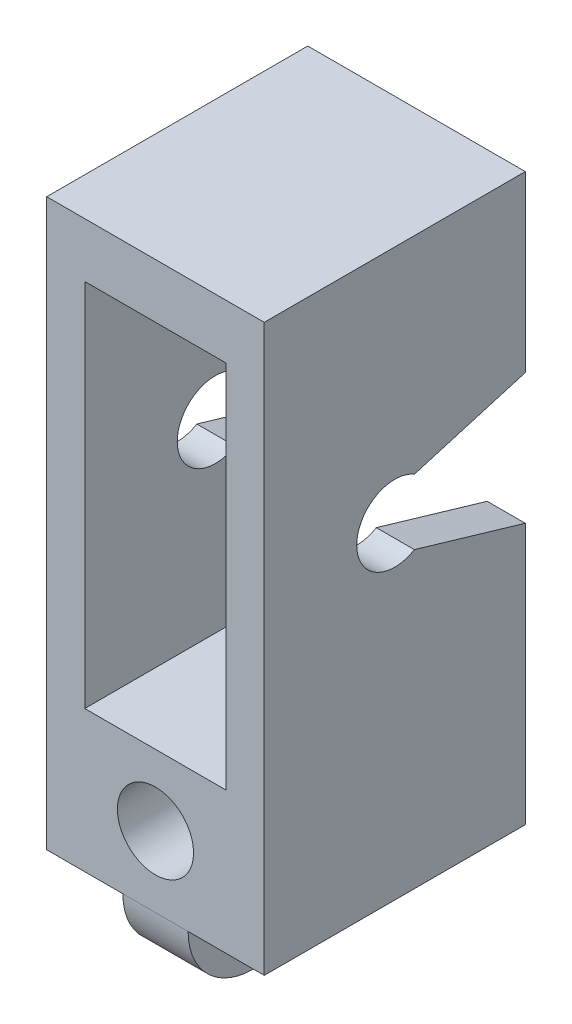
from build123d import *

# Parameters (mm, degrees)
BOSS_EXTRUDE1_DEPTH = 5
SKETCH2_W           = 6.5
SKETCH2_H           = 17
CUT_EXTRUDE1_DEPTH  = 20
CUT_EXTRUDE2_DEPTH  = 2.5
SKETCH4_R           = 1.75
CUT_EXTRUDE3_DEPTH  = 10
BOSS_EXTRUDE2_DEPTH = 1.5


with BuildPart() as part:
    # Sketch1 → Boss-Extrude1 (new, symmetric)
    with BuildSketch(Plane(origin=(0, 0, 0), x_dir=(0, 0, -1), z_dir=(1, 0, 0))):
        with BuildLine():
            Line((-6, 0), (6, 0))
            Line((6, 0), (6, 12))
            Line((6, 12), (0.901387819, 13.5))
            ThreePointArc((0.901387819, 13.5), (-1.75, 15), (0.901387819, 16.5))
            Line((0.901387819, 16.5), (6, 18))
            Line((6, 18), (6, 26))
            Line((6, 26), (-6, 26))
            Line((-6, 26), (-6, 0))
        make_face()
    extrude(amount=BOSS_EXTRUDE1_DEPTH, both=True)

    # Sketch2 → Cut-Extrude1 (cut)
    with BuildSketch(Plane.XY.offset(6)):
        with Locations((0, 15)):
            Rectangle(SKETCH2_W, SKETCH2_H)
    extrude(amount=-CUT_EXTRUDE1_DEPTH, mode=Mode.SUBTRACT)

    # Sketch3 → Cut-Extrude2 (cut)
    with BuildSketch(Plane.XY):
        Polygon((-2.75, 0), (2.75, 0), (2.75, 5.184123402), (0, 6.771836642), (-2.75, 5.184123402), align=None)
    extrude(amount=-CUT_EXTRUDE2_DEPTH, mode=Mode.SUBTRACT)

    # Sketch4 → Cut-Extrude3 (cut, symmetric)
    with BuildSketch(Plane.XY):
        with Locations(Location((0, 3.25, 0), (0, 0, 180))):
            Circle(SKETCH4_R)
    extrude(amount=CUT_EXTRUDE3_DEPTH, both=True, mode=Mode.SUBTRACT)

    # Sketch5 → Boss-Extrude2 (add, symmetric)
    with BuildSketch(Plane(origin=(0, 0, 0), x_dir=(0, 0, -1), z_dir=(1, 0, 0))):
        with BuildLine():
            Line((6, 5), (6, 6.5))
            ThreePointArc((6, 6.5), (9.25, 3.25), (6, 0))
            Line((6, 0), (6, 1.5))
            ThreePointArc((6, 1.5), (7.75, 3.25), (6, 5))
        make_face()
        with BuildLine():
            Line((-4.4, 0), (-6, 0))
            ThreePointArc((-6, 0), (-3, -3), (0, 0))
            Line((0, 0), (-1.6, 0))
            ThreePointArc((-1.6, 0), (-3, -1.4), (-4.4, 0))
        make_face()
    extrude(amount=BOSS_EXTRUDE2_DEPTH, both=True)


solid = part.part
